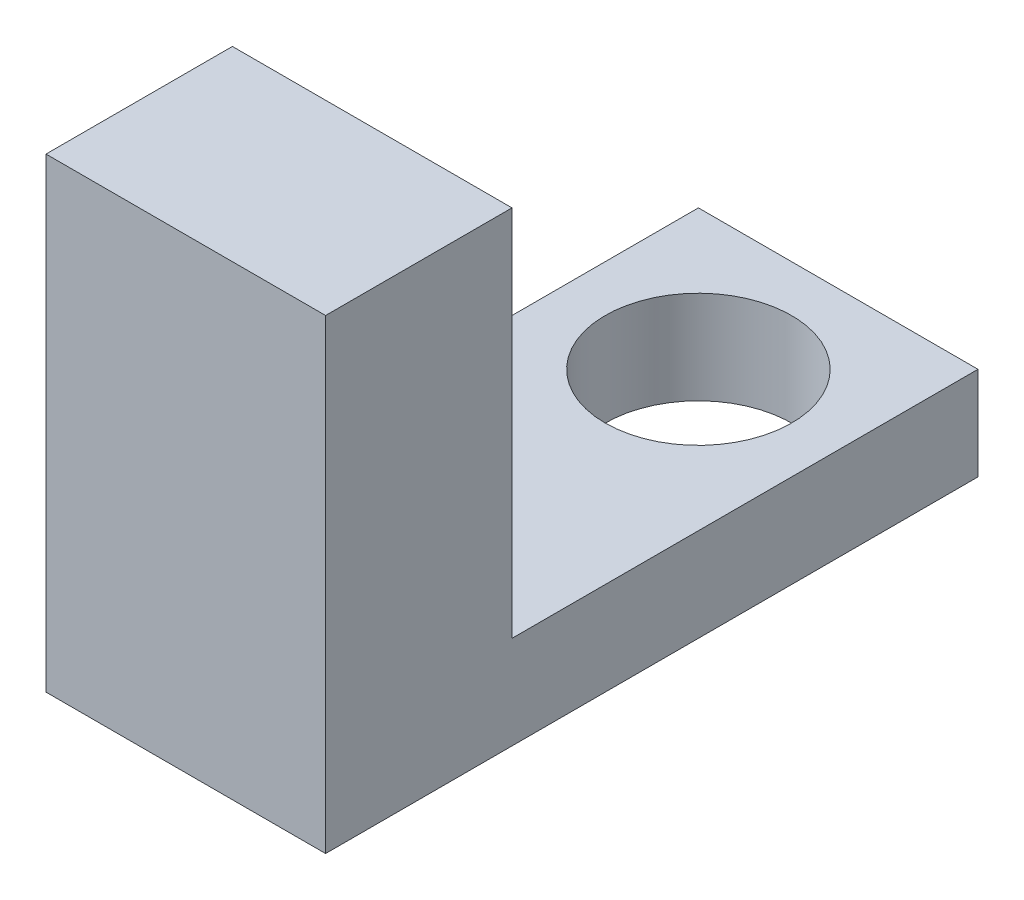
from build123d import *

# Parameters (mm, degrees)
BOSS_EXTRUDE1_DEPTH = 30
SKETCH2_R           = 10
CUT_EXTRUDE1_DEPTH  = 10


with BuildPart() as part:
    # Sketch1 → Boss-Extrude1 (new body)
    with BuildSketch(Plane(origin=(0, 0, 0), x_dir=(0, 0, -1), z_dir=(1, 0, 0))):
        Polygon((0, 40), (0, 0), (50, 0), (50, -10), (-20, -10), (-20, 40), align=None)
    extrude(amount=BOSS_EXTRUDE1_DEPTH)

    # Sketch2 → Cut-Extrude1 (cut)
    with BuildSketch(Plane(origin=(0, 0, 0), x_dir=(1, 0, 0), z_dir=(0, 1, 0))):
        with Locations(Location((15, 35, 0), (0, 0, 270))):
            Circle(SKETCH2_R)
    extrude(amount=-CUT_EXTRUDE1_DEPTH, mode=Mode.SUBTRACT)


solid = part.part
